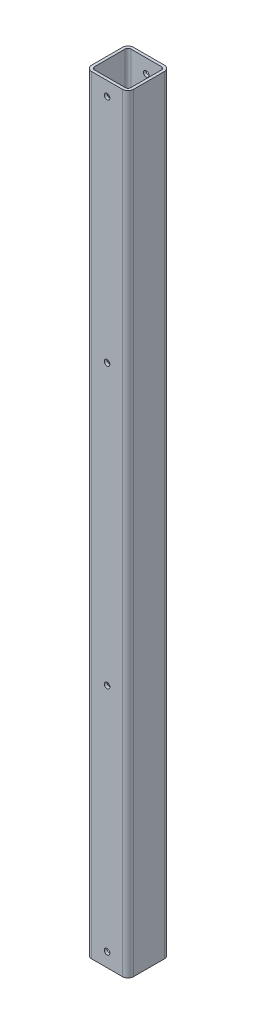
from build123d import *

# Parameters (mm, degrees)
EXTRUDE_1_DEPTH          = 275
CUT_EXTRUDE_1_DEPTH      = 276.816968296
CUT_EXTRUDE_1_DEPTH_BACK = 276.816968296
SKETCH_2_R               = 2


with BuildPart() as part:
    # 草图1 → 凸台-拉伸1 (new, symmetric)
    with BuildSketch(Plane(origin=(0, 0, 0), x_dir=(1, 0, 0), z_dir=(0, 1, 0))):
        with BuildLine():
            Line((-11, -15), (11, -15))
            ThreePointArc((11, -15), (13.828427125, -13.828427125), (15, -11))
            Line((15, -11), (15, 11))
            ThreePointArc((15, 11), (13.828427125, 13.828427125), (11, 15))
            Line((11, 15), (-11, 15))
            ThreePointArc((-11, 15), (-13.828427125, 13.828427125), (-15, 11))
            Line((-15, 11), (-15, -11))
            ThreePointArc((-15, -11), (-13.828427125, -13.828427125), (-11, -15))
        make_face()
        with BuildLine():
            Line((-11, -13), (11, -13))
            ThreePointArc((11, -13), (12.414213562, -12.414213562), (13, -11))
            Line((13, -11), (13, 11))
            ThreePointArc((13, 11), (12.414213562, 12.414213562), (11, 13))
            Line((11, 13), (-11, 13))
            ThreePointArc((-11, 13), (-12.414213562, 12.414213562), (-13, 11))
            Line((-13, 11), (-13, -11))
            ThreePointArc((-13, -11), (-12.414213562, -12.414213562), (-11, -13))
        make_face(mode=Mode.SUBTRACT)
    extrude(amount=EXTRUDE_1_DEPTH, both=True)

    # 草图2 → 切除-拉伸1 (cut, two sides: drawn at the far end of the back side and taken through both)
    with BuildSketch(Plane.XY.offset(-CUT_EXTRUDE_1_DEPTH_BACK)):
        with Locations((0, 265)):
            Circle(SKETCH_2_R)
        with Locations((0, 100)):
            Circle(SKETCH_2_R)
        with Locations((0, -100)):
            Circle(SKETCH_2_R)
        with Locations((0, -265)):
            Circle(SKETCH_2_R)
    extrude(amount=CUT_EXTRUDE_1_DEPTH + CUT_EXTRUDE_1_DEPTH_BACK, mode=Mode.SUBTRACT)


solid = part.part
